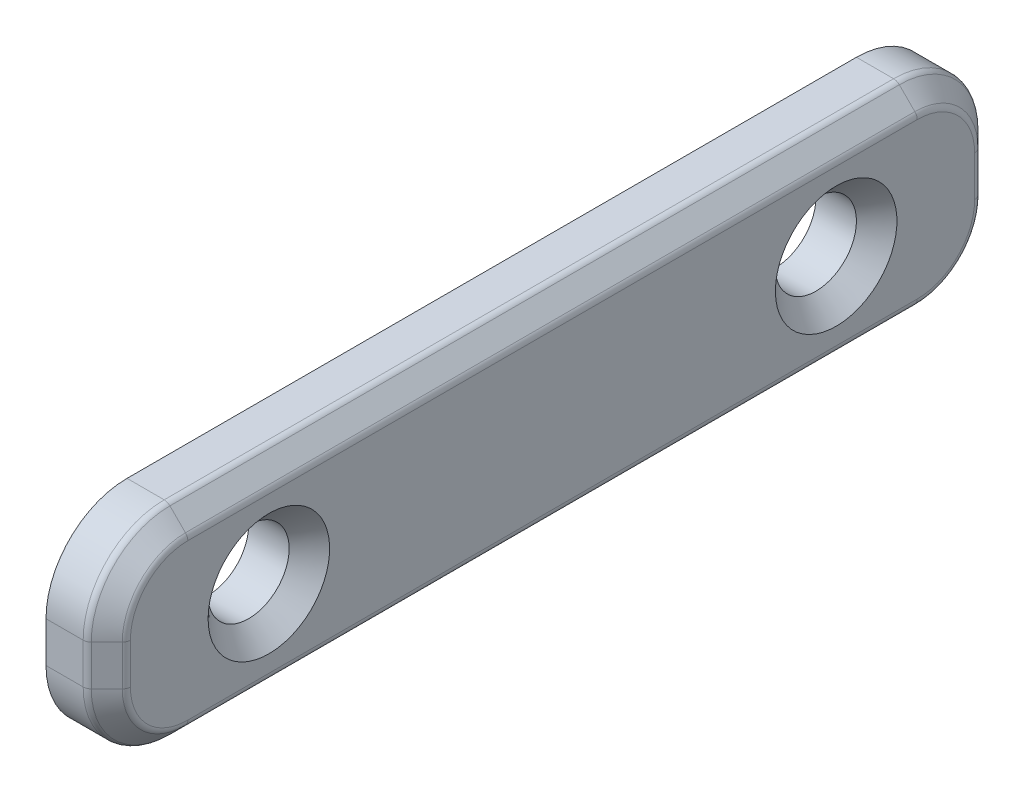
from build123d import *

# Parameters (mm, degrees)
BOSS_EXTRUDE1_DEPTH = 3
CHAMFER1_SIZE       = 1
FILLET1_R           = 0.4
SKETCH2_R           = 2
CUT_EXTRUDE1_DEPTH  = 3
CHAMFER2_SIZE       = 1


with BuildPart() as part:
    # Sketch1 → Boss-Extrude1 (new body)
    with BuildSketch(Plane(origin=(0, 0, 0), x_dir=(0, 0, -1), z_dir=(1, 0, 0))):
        with BuildLine():
            Line((-18, -5), (18, -5))
            ThreePointArc((18, -5), (20.828427125, -3.828427125), (22, -1))
            Line((22, -1), (22, 1))
            ThreePointArc((22, 1), (20.828427125, 3.828427125), (18, 5))
            Line((18, 5), (-18, 5))
            ThreePointArc((-18, 5), (-20.828427125, 3.828427125), (-22, 1))
            Line((-22, 1), (-22, -1))
            ThreePointArc((-22, -1), (-20.828427125, -3.828427125), (-18, -5))
        make_face()
    extrude(amount=BOSS_EXTRUDE1_DEPTH)

    # Chamfer1
    chamfer1_edges = [part.edges().sort_by_distance(p)[0] for p in [
        (3, 3.828427125, 20.828427125),
        (3, 0, 22),
        (3, -3.828427125, 20.828427125),
        (3, -5, 0),
        (3, -3.828427125, -20.828427125),
        (3, 0, -22),
        (3, 3.828427125, -20.828427125),
        (3, 5, 0),
    ]]
    chamfer(chamfer1_edges, length=CHAMFER1_SIZE)

    # Fillet1
    fillet1_edges = [part.edges().sort_by_distance(p)[0] for p in [
        (3, 3.121320344, -20.121320344),
        (3, 4, 0),
        (3, 3.121320344, 20.121320344),
        (3, 0, 21),
        (3, -3.121320344, 20.121320344),
        (3, -4, 0),
        (3, -3.121320344, -20.121320344),
        (3, 0, -21),
        (2, 0, -22),
        (2, -3.828427125, -20.828427125),
        (2, -5, 0),
        (2, -3.828427125, 20.828427125),
        (2, 0, 22),
        (2, 3.828427125, 20.828427125),
        (2, 5, 0),
        (2, 3.828427125, -20.828427125),
    ]]
    fillet(fillet1_edges, radius=FILLET1_R)

    # Sketch2 → Cut-Extrude1 (cut)
    with BuildSketch(Plane(origin=(3, 0, 0), x_dir=(0, 0, -1), z_dir=(1, 0, 0))):
        with Locations((-14, 0)):
            Circle(SKETCH2_R)
        with Locations((14, 0)):
            Circle(SKETCH2_R)
    extrude(amount=-CUT_EXTRUDE1_DEPTH, mode=Mode.SUBTRACT)

    # Chamfer2
    chamfer2_edges = [part.edges().sort_by_distance(p)[0] for p in [
        (3, 0, 16),
        (3, 0, -12),
    ]]
    chamfer(chamfer2_edges, length=CHAMFER2_SIZE)


solid = part.part
